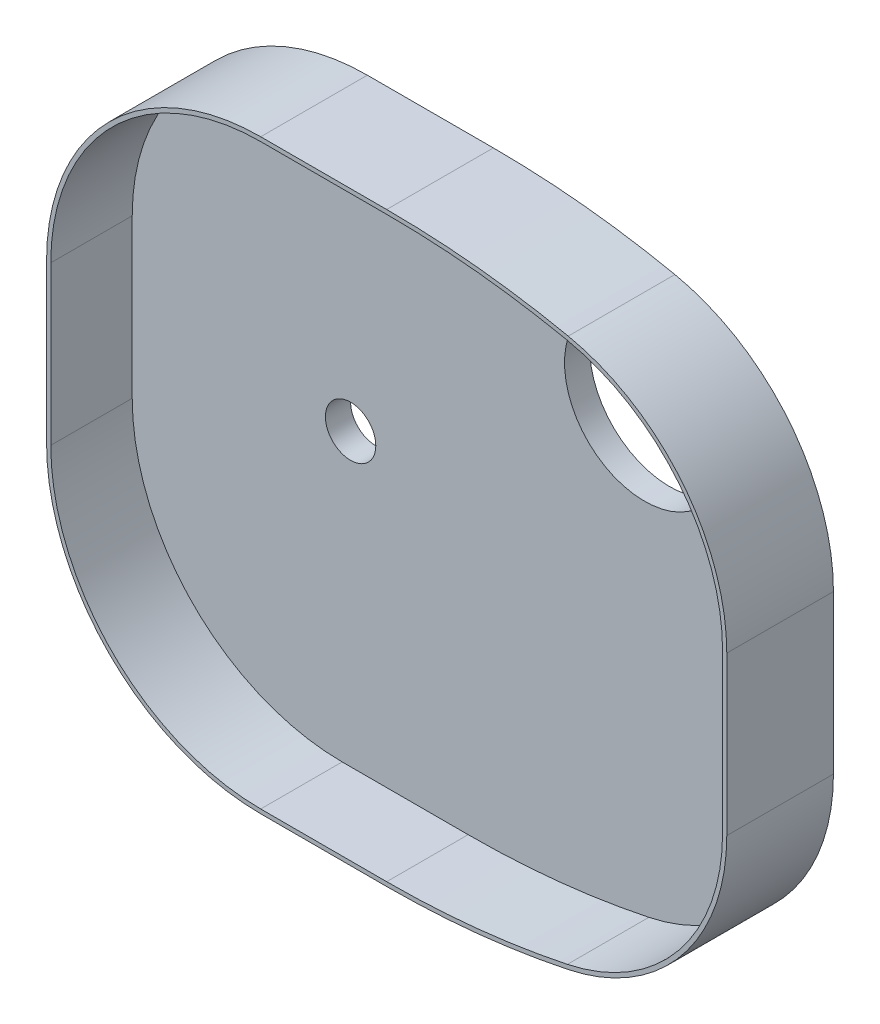
from build123d import *

# Parameters (mm, degrees)
SKETCH1_R           = 19.05
SKETCH1_R_2         = 6
BOSS_EXTRUDE1_DEPTH = 6
BOSS_EXTRUDE2_DEPTH = 25.4


with BuildPart() as part:
    # Sketch1 → Boss-Extrude1 (new body)
    with BuildSketch(Plane.XY):
        with BuildLine():
            Line((27.991748635, 68.822308036), (-2.008251365, 68.822308036))
            ThreePointArc((-2.008251365, 68.822308036), (-37.363590424, 54.177647096), (-52.008251365, 18.822308036))
            Line((-52.008251365, 18.822308036), (-52.008251365, -18.822308036))
            ThreePointArc((-52.008251365, -18.822308036), (-37.363590424, -54.177647096), (-2.008251365, -68.822308036))
            Line((-2.008251365, -68.822308036), (27.991748635, -68.822308036))
            ThreePointArc((27.991748635, -68.822308036), (49.628085606, -67.701435879), (71.032776775, -64.350819837))
            ThreePointArc((71.032776775, -64.350819837), (97.588910481, -48.142996073), (107.991748635, -18.822308036))
            Line((107.991748635, -18.822308036), (107.991748635, 18.822308036))
            ThreePointArc((107.991748635, 18.822308036), (97.588910481, 48.142996073), (71.032776775, 64.350819837))
            ThreePointArc((71.032776775, 64.350819837), (49.628085606, 67.701435879), (27.991748635, 68.822308036))
        make_face()
        with Locations((70, 40)):
            Circle(SKETCH1_R, mode=Mode.SUBTRACT)
        with Locations((0, 0.38867669)):
            Circle(SKETCH1_R_2, mode=Mode.SUBTRACT)
    extrude(amount=BOSS_EXTRUDE1_DEPTH)


with BuildPart() as body_2:
    # Sketch2 → Boss-Extrude2 (new body)
    with BuildSketch(Plane(origin=(0, 0, 0), x_dir=(-1, 0, 0), z_dir=(0, 0, -1))):
        with BuildLine():
            Line((2.008251365, 69.822308036), (-27.991748635, 69.822308036))
            ThreePointArc((-27.991748635, 69.822308036), (-49.731418444, 68.696082713), (-71.238336135, 65.329464487))
            ThreePointArc((-71.238336135, 65.329464487), (-98.365299353, 48.773250244), (-108.991748635, 18.822308036))
            Line((-108.991748635, 18.822308036), (-108.991748635, -18.822308036))
            ThreePointArc((-108.991748635, -18.822308036), (-98.365299353, -48.773250244), (-71.238336135, -65.329464487))
            ThreePointArc((-71.238336135, -65.329464487), (-49.731418444, -68.696082713), (-27.991748635, -69.822308036))
            Line((-27.991748635, -69.822308036), (2.008251365, -69.822308036))
            ThreePointArc((2.008251365, -69.822308036), (38.070697206, -54.884753877), (53.008251365, -18.822308036))
            Line((53.008251365, -18.822308036), (53.008251365, 18.822308036))
            ThreePointArc((53.008251365, 18.822308036), (38.070697206, 54.884753877), (2.008251365, 69.822308036))
        make_face()
        with BuildLine():
            Line((2.008251365, 68.822308036), (-27.991748635, 68.822308036))
            ThreePointArc((-27.991748635, 68.822308036), (-49.628085606, 67.701435879), (-71.032776775, 64.350819837))
            ThreePointArc((-71.032776775, 64.350819837), (-97.588910481, 48.142996073), (-107.991748635, 18.822308036))
            Line((-107.991748635, 18.822308036), (-107.991748635, -18.822308036))
            ThreePointArc((-107.991748635, -18.822308036), (-97.588910481, -48.142996073), (-71.032776775, -64.350819837))
            ThreePointArc((-71.032776775, -64.350819837), (-49.628085606, -67.701435879), (-27.991748635, -68.822308036))
            Line((-27.991748635, -68.822308036), (2.008251365, -68.822308036))
            ThreePointArc((2.008251365, -68.822308036), (37.363590424, -54.177647096), (52.008251365, -18.822308036))
            Line((52.008251365, -18.822308036), (52.008251365, 18.822308036))
            ThreePointArc((52.008251365, 18.822308036), (37.363590424, 54.177647096), (2.008251365, 68.822308036))
        make_face(mode=Mode.SUBTRACT)
    extrude(amount=-BOSS_EXTRUDE2_DEPTH)


solid = Compound([part.part, body_2.part])
